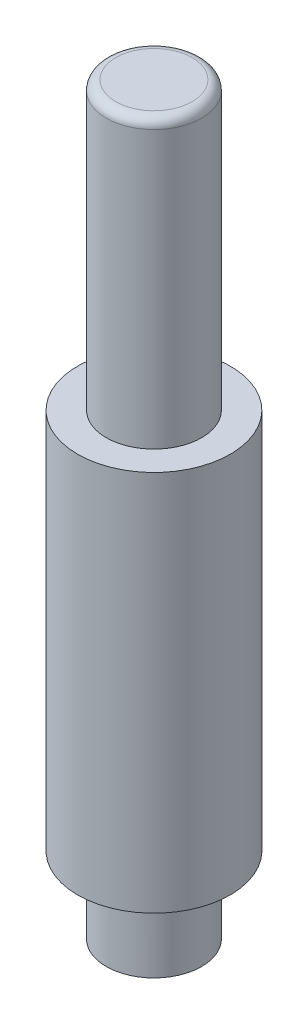
from build123d import *

# Parameters (mm, degrees)
SKETCH9_R                               = 5
BOSS_EXTRUDE7_DEPTH                     = 7.5
SKETCH10_R                              = 4.5
BOSS_EXTRUDE8_DEPTH                     = 0.5
SKETCH11_R                              = 8
BOSS_EXTRUDE9_DEPTH                     = 40
SKETCH12_R                              = 5
BOSS_EXTRUDE10_DEPTH                    = 30
FILLET7_R                               = 1
CBORE_FOR_M6_HEX_HEAD_BOLT2_D           = 6.6
CBORE_FOR_M6_HEX_HEAD_BOLT2_DEPTH       = 10
CBORE_FOR_M6_HEX_HEAD_BOLT2_CBORE_D     = 14.547
CBORE_FOR_M6_HEX_HEAD_BOLT2_CBORE_DEPTH = 4
CBORE_FOR_M6_HEX_HEAD_BOLT2_TIP         = 1.982840043
BOSS_EXTRUDE11_START                    = 4
SKETCH27_R                              = 5
BOSS_EXTRUDE11_DEPTH                    = 4
CUT_EXTRUDE1_START                      = -5
SKETCH28_R                              = 3.3
CUT_EXTRUDE1_DEPTH                      = 5


with BuildPart() as part:
    # Sketch9 → Boss-Extrude7 (new body)
    with BuildSketch(Plane(origin=(0, 0, 0), x_dir=(1, 0, 0), z_dir=(0, 1, 0))):
        with Locations(Location((0, 0, 0), (0, 0, 270))):
            Circle(SKETCH9_R)
    extrude(amount=BOSS_EXTRUDE7_DEPTH)

    # Sketch10 → Boss-Extrude8 (add)
    with BuildSketch(Plane(origin=(0, 7.5, 0), x_dir=(1, 0, 0), z_dir=(0, 1, 0))):
        with Locations(Location((0, 0, 0), (0, 0, 270))):
            Circle(SKETCH10_R)
    extrude(amount=BOSS_EXTRUDE8_DEPTH)

    # Sketch11 → Boss-Extrude9 (add)
    with BuildSketch(Plane(origin=(0, 8, 0), x_dir=(1, 0, 0), z_dir=(0, 1, 0))):
        with Locations(Location((0, 0, 0), (0, 0, 270))):
            Circle(SKETCH11_R)
    extrude(amount=BOSS_EXTRUDE9_DEPTH)

    # Sketch12 → Boss-Extrude10 (add)
    with BuildSketch(Plane(origin=(0, 48, 0), x_dir=(1, 0, 0), z_dir=(0, 1, 0))):
        with Locations(Location((0, 0, 0), (0, 0, 270))):
            Circle(SKETCH12_R)
    extrude(amount=BOSS_EXTRUDE10_DEPTH)

    # Fillet7
    fillet7_edges = [part.edges().sort_by_distance(p)[0] for p in [
        (0, 78, -5),
    ]]
    fillet(fillet7_edges, radius=FILLET7_R)

    # CBORE for M6 Hex Head Bolt2
    with Locations(Plane(origin=(0, 0, 0), x_dir=(-1, 0, 0), z_dir=(0, -1, 0))):
        with Locations((0, 0)):
            CounterBoreHole(CBORE_FOR_M6_HEX_HEAD_BOLT2_D / 2, CBORE_FOR_M6_HEX_HEAD_BOLT2_CBORE_D / 2, CBORE_FOR_M6_HEX_HEAD_BOLT2_CBORE_DEPTH, depth=CBORE_FOR_M6_HEX_HEAD_BOLT2_DEPTH)
            with Locations((0, 0, -(CBORE_FOR_M6_HEX_HEAD_BOLT2_DEPTH + CBORE_FOR_M6_HEX_HEAD_BOLT2_TIP / 2))):  # 118° drill point
                Cone(0, CBORE_FOR_M6_HEX_HEAD_BOLT2_D / 2, CBORE_FOR_M6_HEX_HEAD_BOLT2_TIP, mode=Mode.SUBTRACT)

    # Sketch27 → Boss-Extrude11 (add)
    with BuildSketch(Plane.XZ.offset(-4).offset(BOSS_EXTRUDE11_START)):
        with Locations(Location((0, 0, 0), (0, 0, 270))):
            Circle(SKETCH27_R)
    extrude(amount=-BOSS_EXTRUDE11_DEPTH)

    # Sketch28 → Cut-Extrude1 (cut)
    with BuildSketch(Plane.XZ.offset(CUT_EXTRUDE1_START)):
        with Locations(Location((0, 0, 0), (0, 0, 270))):
            Circle(SKETCH28_R)
    extrude(amount=CUT_EXTRUDE1_DEPTH, mode=Mode.SUBTRACT)


solid = part.part
